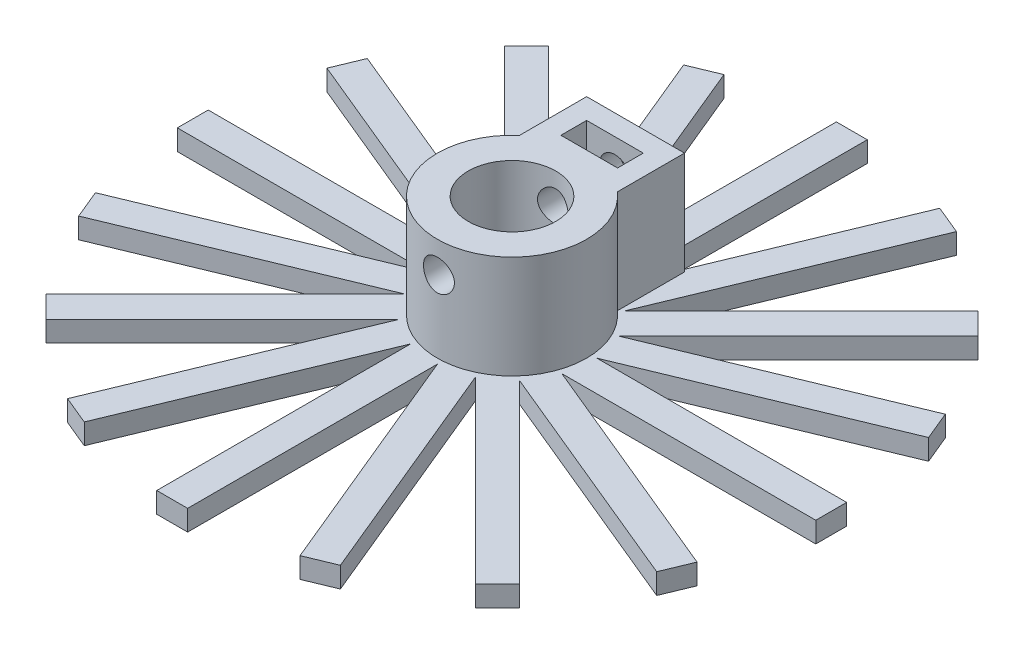
from build123d import *

# Parameters (mm, degrees)
SKETCH1_R               = 7.25
SKETCH1_R_2             = 4.25
SKETCH1_W               = 3
SKETCH1_H               = 32
SKETCH1_W_2             = 32
SKETCH1_H_2             = 3
BOSS_EXTRUDE1_DEPTH     = 2
SKETCH1_3_R             = 7.25
SKETCH1_3_R_2           = 4.25
BOSS_EXTRUDE2_DEPTH     = 12
SKETCH5_W               = 9.5
SKETCH5_H               = 6.5
SKETCH5_W_2             = 5.5
SKETCH5_H_2             = 2.5
BOSS_EXTRUDE3_DEPTH     = 10
CUT_EXTRUDE1_DEPTH      = 47.818799643
CUT_EXTRUDE1_DEPTH_BACK = 47.818799643
SKETCH2_R               = 1.5
CUT_EXTRUDE3_DEPTH      = 47.818799643
CUT_EXTRUDE3_DEPTH_BACK = 47.818799643
SKETCH3_R               = 4.25


with BuildPart() as part:
    # Sketch1 → Boss-Extrude1 (new body)
    # profile 1 of 17: a face of its own
    with BuildSketch(Plane(origin=(0, 0, 0), x_dir=(1, 0, 0), z_dir=(0, 1, 0))):
        Circle(SKETCH1_R)
        Circle(SKETCH1_R_2, mode=Mode.SUBTRACT)
    # profile 2 of 17: a face of its own
    with BuildSketch(Plane(origin=(0, 0, 0), x_dir=(1, 0, 0), z_dir=(0, 1, 0))):
        Polygon((-0.461939766, 0.191341716), (11.783930069, 29.755486757), (14.555568667, 28.607436459), (2.309698831, -0.956708581), align=None)
    # profile 3 of 17: a face of its own
    with BuildSketch(Plane(origin=(0, 0, 0), x_dir=(1, 0, 0), z_dir=(0, 1, 0))):
        with Locations((1, 16)):
            Rectangle(SKETCH1_W, SKETCH1_H)
    # profile 4 of 17: a face of its own
    with BuildSketch(Plane(origin=(0, 0, 0), x_dir=(1, 0, 0), z_dir=(0, 1, 0))):
        Polygon((-0.353553391, 0.353553391), (22.273863607, 22.980970389), (24.395183951, 20.859650045), (1.767766953, -1.767766953), align=None)
    # profile 5 of 17: a face of its own
    with BuildSketch(Plane(origin=(0, 0, 0), x_dir=(1, 0, 0), z_dir=(0, 1, 0))):
        Polygon((-0.191341716, 0.461939766), (29.372803324, 12.707809602), (30.520853621, 9.936171004), (0.956708581, -2.309698831), align=None)
    # profile 6 of 17: a face of its own
    with BuildSketch(Plane(origin=(0, 0, 0), x_dir=(1, 0, 0), z_dir=(0, 1, 0))):
        with Locations((16, -1)):
            Rectangle(SKETCH1_W_2, SKETCH1_H_2)
    # profile 7 of 17: a face of its own
    with BuildSketch(Plane(origin=(0, 0, 0), x_dir=(1, 0, 0), z_dir=(0, 1, 0))):
        Polygon((0.191341716, 0.461939766), (29.755486757, -11.783930069), (28.607436459, -14.555568667), (-0.956708581, -2.309698831), align=None)
    # profile 8 of 17: a face of its own
    with BuildSketch(Plane(origin=(0, 0, 0), x_dir=(1, 0, 0), z_dir=(0, 1, 0))):
        Polygon((0.353553391, 0.353553391), (22.980970389, -22.273863607), (20.859650045, -24.395183951), (-1.767766953, -1.767766953), align=None)
    # profile 9 of 17: a face of its own
    with BuildSketch(Plane(origin=(0, 0, 0), x_dir=(1, 0, 0), z_dir=(0, 1, 0))):
        Polygon((0.461939766, 0.191341716), (12.707809602, -29.372803324), (9.936171004, -30.520853621), (-2.309698831, -0.956708581), align=None)
    # profile 10 of 17: a face of its own
    with BuildSketch(Plane(origin=(0, 0, 0), x_dir=(1, 0, 0), z_dir=(0, 1, 0))):
        with Locations((-1, -16)):
            Rectangle(SKETCH1_W, SKETCH1_H)
    # profile 11 of 17: a face of its own
    with BuildSketch(Plane(origin=(0, 0, 0), x_dir=(1, 0, 0), z_dir=(0, 1, 0))):
        Polygon((0.461939766, -0.191341716), (-11.783930069, -29.755486757), (-14.555568667, -28.607436459), (-2.309698831, 0.956708581), align=None)
    # profile 12 of 17: a face of its own
    with BuildSketch(Plane(origin=(0, 0, 0), x_dir=(1, 0, 0), z_dir=(0, 1, 0))):
        Polygon((0.353553391, -0.353553391), (-22.273863607, -22.980970389), (-24.395183951, -20.859650045), (-1.767766953, 1.767766953), align=None)
    # profile 13 of 17: a face of its own
    with BuildSketch(Plane(origin=(0, 0, 0), x_dir=(1, 0, 0), z_dir=(0, 1, 0))):
        Polygon((0.191341716, -0.461939766), (-29.372803324, -12.707809602), (-30.520853621, -9.936171004), (-0.956708581, 2.309698831), align=None)
    # profile 14 of 17: a face of its own
    with BuildSketch(Plane(origin=(0, 0, 0), x_dir=(1, 0, 0), z_dir=(0, 1, 0))):
        with Locations((-16, 1)):
            Rectangle(SKETCH1_W_2, SKETCH1_H_2)
    # profile 15 of 17: a face of its own
    with BuildSketch(Plane(origin=(0, 0, 0), x_dir=(1, 0, 0), z_dir=(0, 1, 0))):
        Polygon((-0.191341716, -0.461939766), (-29.755486757, 11.783930069), (-28.607436459, 14.555568667), (0.956708581, 2.309698831), align=None)
    # profile 16 of 17: a face of its own
    with BuildSketch(Plane(origin=(0, 0, 0), x_dir=(1, 0, 0), z_dir=(0, 1, 0))):
        Polygon((-0.353553391, -0.353553391), (-22.980970389, 22.273863607), (-20.859650045, 24.395183951), (1.767766953, 1.767766953), align=None)
    # profile 17 of 17: a face of its own
    with BuildSketch(Plane(origin=(0, 0, 0), x_dir=(1, 0, 0), z_dir=(0, 1, 0))):
        Polygon((-0.461939766, -0.191341716), (-12.707809602, 29.372803324), (-9.936171004, 30.520853621), (2.309698831, 0.956708581), align=None)
    extrude(amount=BOSS_EXTRUDE1_DEPTH)

    # Sketch1<3> → Boss-Extrude2 (add)
    with BuildSketch(Plane(origin=(0, 0, 0), x_dir=(1, 0, 0), z_dir=(0, 1, 0))):
        Circle(SKETCH1_3_R)
        Circle(SKETCH1_3_R_2, mode=Mode.SUBTRACT)
    extrude(amount=BOSS_EXTRUDE2_DEPTH)

    # Sketch5 → Boss-Extrude3 (add)
    with BuildSketch(Plane(origin=(0, 12, 0), x_dir=(1, 0, 0), z_dir=(0, 1, 0))):
        with Locations((0, 8.75)):
            Rectangle(SKETCH5_W, SKETCH5_H)
        with Locations((0, 8.75)):
            Rectangle(SKETCH5_W_2, SKETCH5_H_2, mode=Mode.SUBTRACT)
    extrude(amount=-BOSS_EXTRUDE3_DEPTH)

    # Sketch2 → Cut-Extrude1 (cut, two sides: drawn at the far end of the back side and taken through both)
    with BuildSketch(Plane.XY.offset(-CUT_EXTRUDE1_DEPTH_BACK)):
        with Locations((0, 9)):
            Circle(SKETCH2_R)
    extrude(amount=CUT_EXTRUDE1_DEPTH + CUT_EXTRUDE1_DEPTH_BACK, mode=Mode.SUBTRACT)

    # Sketch3 → Cut-Extrude3 (cut, two sides: drawn at the far end of the back side and taken through both)
    with BuildSketch(Plane(origin=(0, 12, 0), x_dir=(1, 0, 0), z_dir=(0, 1, 0)).offset(-CUT_EXTRUDE3_DEPTH_BACK)):
        Circle(SKETCH3_R)
    extrude(amount=CUT_EXTRUDE3_DEPTH + CUT_EXTRUDE3_DEPTH_BACK, mode=Mode.SUBTRACT)


solid = part.part
